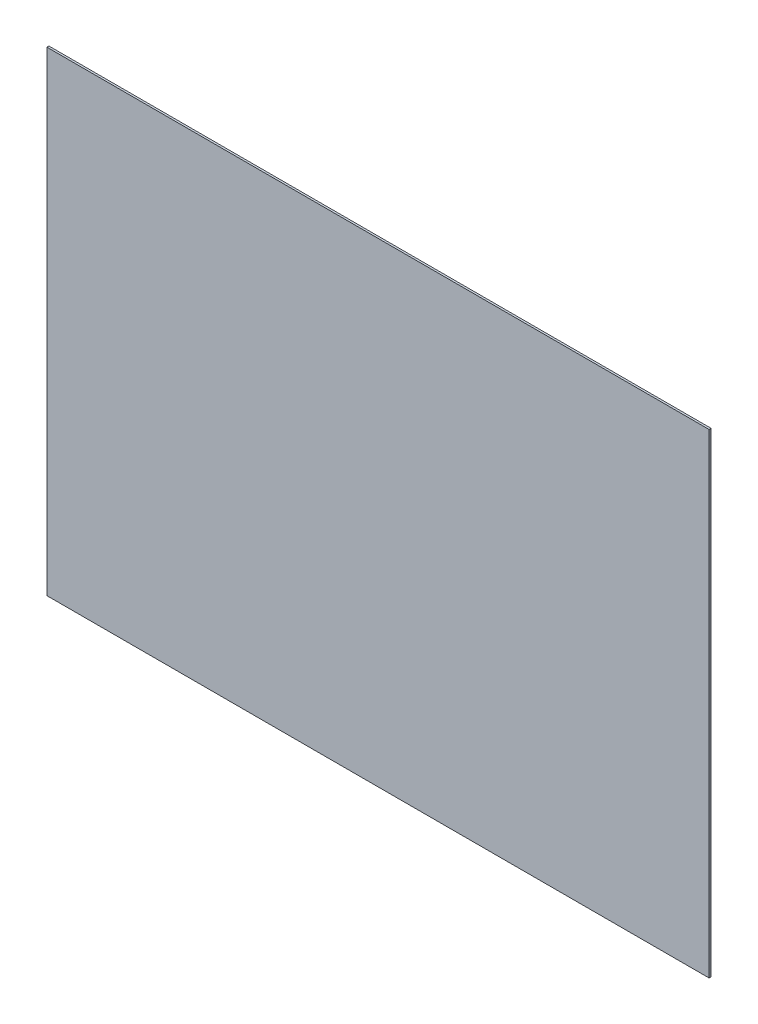
from build123d import *

# Parameters (mm, degrees)
SKETCH1_W           = 495.4
SKETCH1_H           = 355.4
BOSS_EXTRUDE1_DEPTH = 1.5


with BuildPart() as part:
    # Sketch1 → Boss-Extrude1 (new body)
    with BuildSketch(Plane.XY):
        Rectangle(SKETCH1_W, SKETCH1_H)
    extrude(amount=BOSS_EXTRUDE1_DEPTH)


solid = part.part
